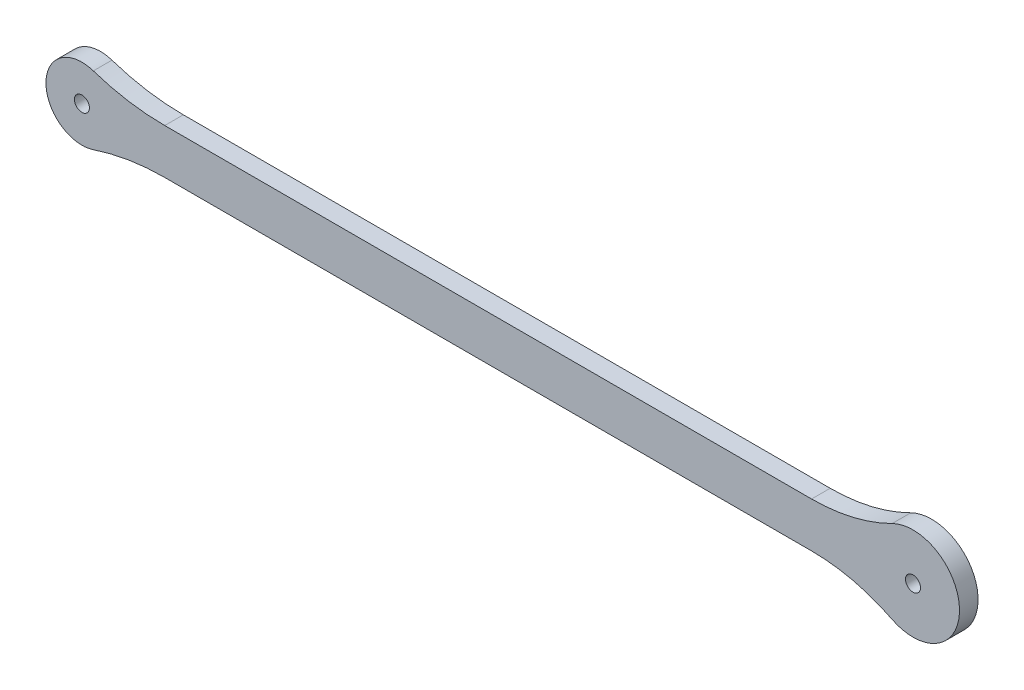
from build123d import *

# Parameters (mm, degrees)
SKETCH1_R           = 2.5
BOSS_EXTRUDE1_DEPTH = 6.2


with BuildPart() as part:
    # Sketch1 → Boss-Extrude1 (new body)
    with BuildSketch(Plane.XY):
        with BuildLine():
            Line((104.746949389, 7.5), (-110.952089481, 7.5))
            ThreePointArc((-110.952089481, 7.5), (-123.013355498, 8.476180441), (-134.760648928, 11.379310345))
            ThreePointArc((-134.760648928, 11.379310345), (-150.57001844, 0), (-134.760648928, -11.379310345))
            ThreePointArc((-134.760648928, -11.379310345), (-123.013355498, -8.476180441), (-110.952089481, -7.5))
            Line((-110.952089481, -7.5), (104.746949389, -7.5))
            ThreePointArc((104.746949389, -7.5), (118.557397493, -9.111032522), (131.626209562, -13.857615894))
            ThreePointArc((131.626209562, -13.857615894), (154.07001844, 0), (131.626209562, 13.857615894))
            ThreePointArc((131.626209562, 13.857615894), (118.557397493, 9.111032522), (104.746949389, 7.5))
        make_face()
        with Locations(Location((-138.57001844, 0, 0), (0, 0, 180))):
            Circle(SKETCH1_R, mode=Mode.SUBTRACT)
        with Locations(Location((138.57001844, 0, 0), (0, 0, 180))):
            Circle(SKETCH1_R, mode=Mode.SUBTRACT)
    extrude(amount=BOSS_EXTRUDE1_DEPTH)


solid = part.part
